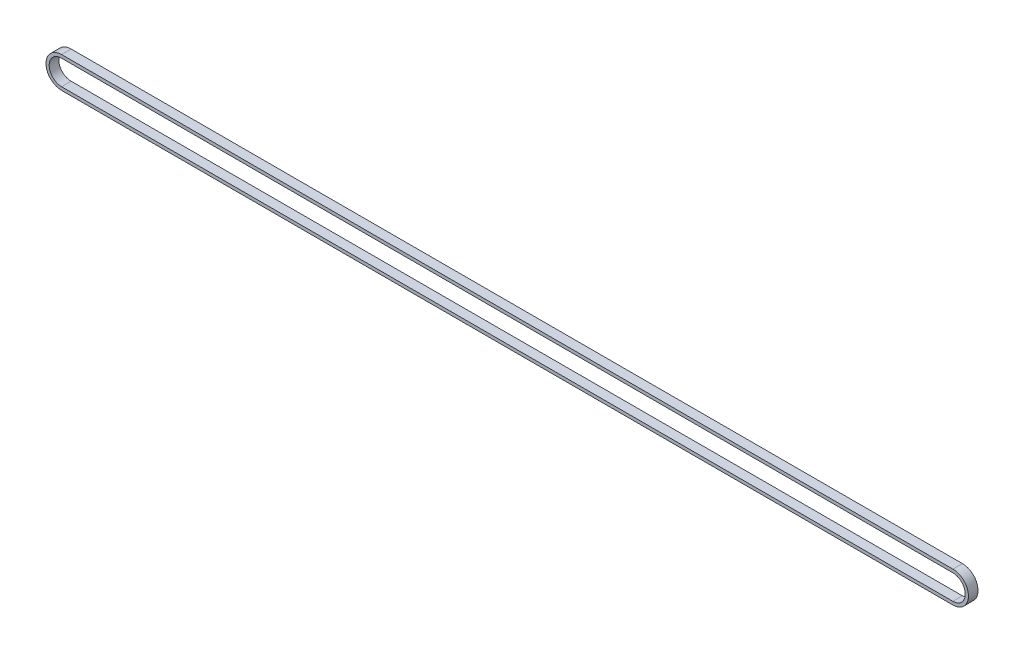
from build123d import *

# Parameters (mm, degrees)
BOSS_EXTRUDE1_DEPTH = 6


with BuildPart() as part:
    # Sketch1 → Boss-Extrude1 (new body)
    with BuildSketch(Plane.XY):
        with BuildLine():
            Line((0, 9.75), (559, 9.75))
            ThreePointArc((559, 9.75), (568.75, 0), (559, -9.75))
            Line((559, -9.75), (0, -9.75))
            ThreePointArc((0, -9.75), (-9.75, 0), (0, 9.75))
        make_face()
        with BuildLine():
            Line((0, 7.75), (559, 7.75))
            ThreePointArc((559, 7.75), (566.75, 0), (559, -7.75))
            Line((559, -7.75), (0, -7.75))
            ThreePointArc((0, -7.75), (-7.75, 0), (0, 7.75))
        make_face(mode=Mode.SUBTRACT)
    extrude(amount=BOSS_EXTRUDE1_DEPTH)


solid = part.part
